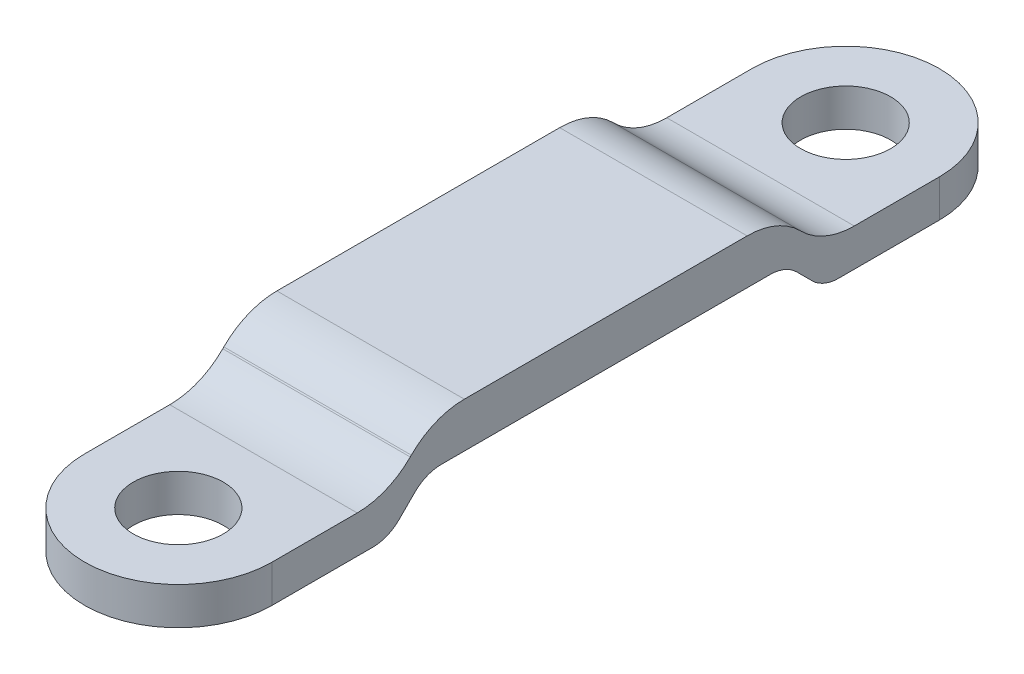
from build123d import *

# Parameters (mm, degrees)
BOSS_EXTRUDE2_DEPTH = 12.5
SKETCH2_R           = 6
CUT_EXTRUDE1_DEPTH  = 59.662168388
FILLET1_RADIUS      = 12.5
FILLET1_LENGTH      = 5
FILLET2_RADIUS      = 12.5
FILLET2_LENGTH      = 5


with BuildPart() as part:
    # Sketch1 → Boss-Extrude2 (new, symmetric)
    with BuildSketch(Plane(origin=(0, 0, 0), x_dir=(0, 0, -1), z_dir=(1, 0, 0))):
        with BuildLine():
            Line((0, 5), (0, 11))
            Line((0, 11), (-18.857864376, 11))
            ThreePointArc((-18.857864376, 11), (-22.6846987, 10.238795325), (-25.928932188, 8.071067812))
            Line((-25.928932188, 8.071067812), (-26.071067812, 7.928932188))
            ThreePointArc((-26.071067812, 7.928932188), (-29.3153013, 5.761204675), (-33.142135624, 5))
            Line((-33.142135624, 5), (-57, 5))
            Line((-57, 5), (-57, 0))
            Line((-57, 0), (-31.071067812, 0))
            ThreePointArc((-31.071067812, 0), (-29.15765065, 0.380602337), (-27.535533906, 1.464466094))
            Line((-27.535533906, 1.464466094), (-25.464466094, 3.535533906))
            ThreePointArc((-25.464466094, 3.535533906), (-23.84234935, 4.619397663), (-21.928932188, 5))
            Line((-21.928932188, 5), (0, 5))
        make_face()
        with BuildLine():
            Line((18.857864376, 11), (0, 11))
            Line((0, 11), (0, 5))
            Line((0, 5), (21.928932188, 5))
            ThreePointArc((21.928932188, 5), (23.84234935, 4.619397663), (25.464466094, 3.535533906))
            Line((25.464466094, 3.535533906), (27.535533906, 1.464466094))
            ThreePointArc((27.535533906, 1.464466094), (29.15765065, 0.380602337), (31.071067812, 0))
            Line((31.071067812, 0), (57, 0))
            Line((57, 0), (57, 5))
            Line((57, 5), (33.142135624, 5))
            ThreePointArc((33.142135624, 5), (29.3153013, 5.761204675), (26.071067812, 7.928932188))
            Line((26.071067812, 7.928932188), (25.928932188, 8.071067812))
            ThreePointArc((25.928932188, 8.071067812), (22.6846987, 10.238795325), (18.857864376, 11))
        make_face()
    extrude(amount=BOSS_EXTRUDE2_DEPTH, both=True)

    # Sketch2 → Cut-Extrude1 (cut, through all)
    with BuildSketch(Plane(origin=(0, 5, 0), x_dir=(1, 0, 0), z_dir=(0, 1, 0))):
        with Locations(Location((0, 44.5, 0), (0, 0, 270))):
            Circle(SKETCH2_R)
        with Locations(Location((0, -44.5, 0), (0, 0, 90))):
            Circle(SKETCH2_R)
    extrude(amount=-CUT_EXTRUDE1_DEPTH, mode=Mode.SUBTRACT)

    # Fillet1: full round fillet: the end face becomes a half cylinder, R = half its width
    fillet1_face = Plane((0, 2.5, -57), x_dir=(0, 1, 0), z_dir=(0, 0, -1))  # on the end face: x along it, z out of the body
    fillet1_slab = fillet1_face.offset(-FILLET1_RADIUS / 2) * Box(FILLET1_LENGTH, 2 * FILLET1_RADIUS, FILLET1_RADIUS, mode=Mode.PRIVATE)  # the body's end, R deep
    fillet1_round = Plane((0, 2.5, -44.5), x_dir=(0, 0, -1), z_dir=(0, 1, 0)) * Cylinder(FILLET1_RADIUS, FILLET1_LENGTH, mode=Mode.PRIVATE)  # its axis R under the face
    add(fillet1_slab - fillet1_round, mode=Mode.SUBTRACT)

    # Fillet2: full round fillet: the end face becomes a half cylinder, R = half its width
    fillet2_face = Plane((0, 2.5, 57), x_dir=(0, -1, 0), z_dir=(0, 0, 1))  # on the end face: x along it, z out of the body
    fillet2_slab = fillet2_face.offset(-FILLET2_RADIUS / 2) * Box(FILLET2_LENGTH, 2 * FILLET2_RADIUS, FILLET2_RADIUS, mode=Mode.PRIVATE)  # the body's end, R deep
    fillet2_round = Plane((0, 2.5, 44.5), x_dir=(0, 0, 1), z_dir=(0, -1, 0)) * Cylinder(FILLET2_RADIUS, FILLET2_LENGTH, mode=Mode.PRIVATE)  # its axis R under the face
    add(fillet2_slab - fillet2_round, mode=Mode.SUBTRACT)


solid = part.part
